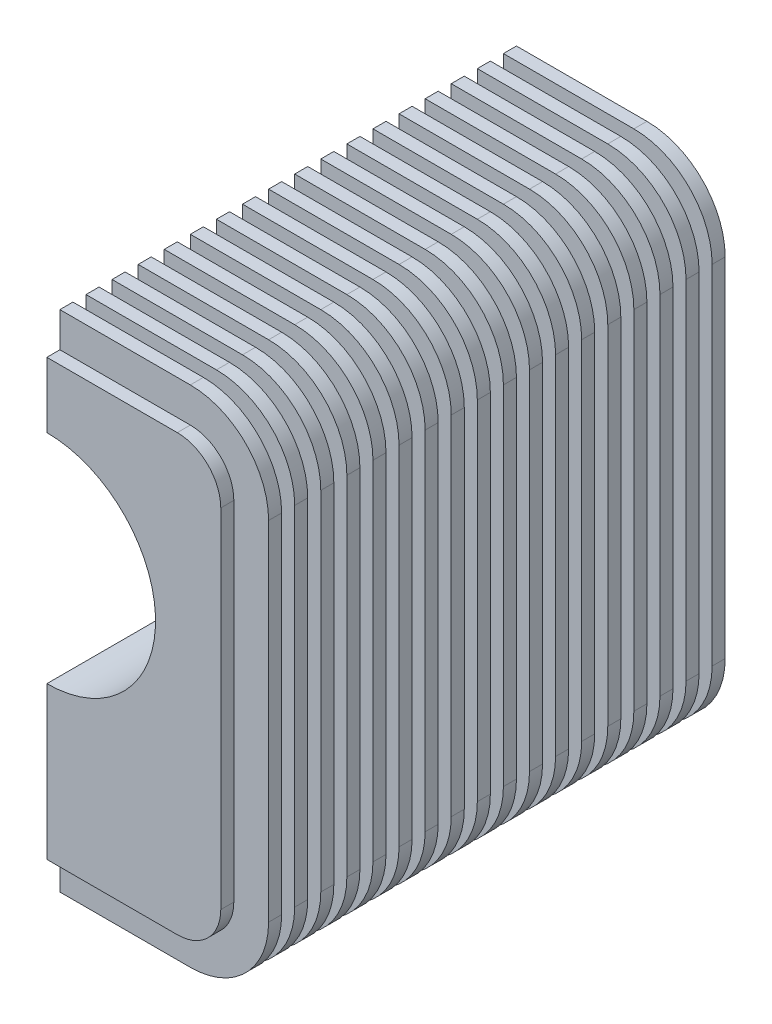
from build123d import *

# Parameters (mm, degrees)
DODANIE_WYCI_GNI_CIE1_DEPTH = 108
SZKIC2_R                    = 25
WYTNIJ_WYCI_GNI_CIE1_DEPTH  = 150.295009963
DODANIE_WYCI_GNI_CIE2_DEPTH = 3
SZYK_LINIOWY1_COUNT         = 18
SZYK_LINIOWY1_PITCH         = 6


with BuildPart() as part:
    # Szkic1 → Dodanie-wyciągnięcie1 (new body)
    with BuildSketch(Plane.XY):
        with BuildLine():
            Line((0, -95), (30, -95))
            ThreePointArc((30, -95), (37.071067812, -92.071067812), (40, -85))
            Line((40, -85), (40, -5))
            ThreePointArc((40, -5), (37.071067812, 2.071067812), (30, 5))
            Line((30, 5), (0, 5))
            Line((0, 5), (0, -95))
        make_face()
    extrude(amount=DODANIE_WYCI_GNI_CIE1_DEPTH)

    # Szkic2 → Wytnij-wyciągnięcie1 (cut, through all)
    with BuildSketch(Plane.XY.offset(108)):
        with Locations((0, -35)):
            Circle(SZKIC2_R)
    extrude(amount=-WYTNIJ_WYCI_GNI_CIE1_DEPTH, mode=Mode.SUBTRACT)

    # Szkic4 → Dodanie-wyciągnięcie2 (add)
    with BuildSketch(Plane(origin=(0, 0, 0), x_dir=(-1, 0, 0), z_dir=(0, 0, -1))):
        with BuildLine():
            Line((0, -95), (-30, -95))
            ThreePointArc((-30, -95), (-37.071067812, -92.071067812), (-40, -85))
            Line((-40, -85), (-40, -5))
            ThreePointArc((-40, -5), (-37.071067812, 2.071067812), (-30, 5))
            Line((-30, 5), (0, 5))
            Line((0, 5), (0, 13))
            Line((0, 13), (-30, 13))
            ThreePointArc((-30, 13), (-42.727922061, 7.727922061), (-48, -5))
            Line((-48, -5), (-48, -85))
            ThreePointArc((-48, -85), (-42.727922061, -97.727922061), (-30, -103))
            Line((-30, -103), (0, -103))
            Line((0, -103), (0, -95))
        make_face()
    dodanie_wyci_gni_cie2 = extrude(amount=-DODANIE_WYCI_GNI_CIE2_DEPTH)

    # Szyk liniowy1: Dodanie-wyciągnięcie2 ×18
    with Locations(*[(0, 0, i * SZYK_LINIOWY1_PITCH) for i in range(1, SZYK_LINIOWY1_COUNT)]):
        add(dodanie_wyci_gni_cie2)


solid = part.part
